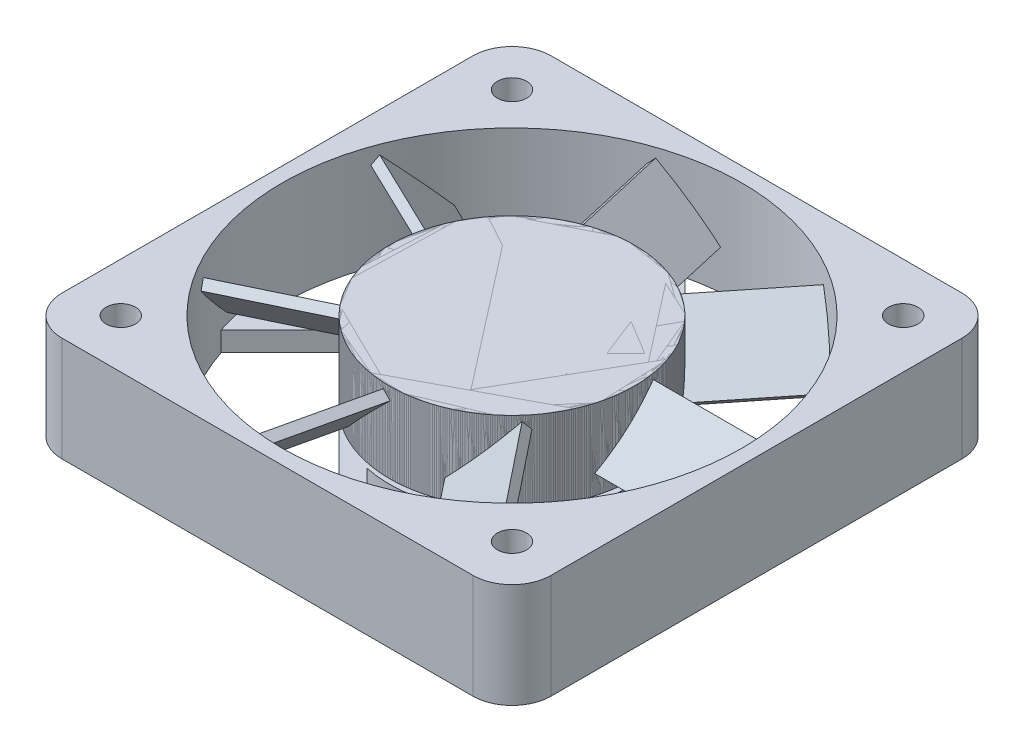
from build123d import *

# Parameters (mm, degrees)
SKETCH1_R                = 23.5
SKETCH1_R_2              = 1.5
BOSS_EXTRUDE1_DEPTH      = 10.7
BOSS_EXTRUDE2_DEPTH      = 2
SKETCH3_R                = 12.5
BOSS_EXTRUDE3_DEPTH      = 8.2
BOSS_EXTRUDE4_REACH      = 38.939
BOSS_EXTRUDE4_END_RADIUS = 23
CIRPATTERN3_COUNT        = 7


with BuildPart() as part:
    # Sketch1 → Boss-Extrude1 (new body)
    with BuildSketch(Plane(origin=(0, 0, 0), x_dir=(1, 0, 0), z_dir=(0, 1, 0))):
        with BuildLine():
            Line((-21, 25), (21, 25))
            ThreePointArc((21, 25), (23.828427125, 23.828427125), (25, 21))
            Line((25, 21), (25, -21))
            ThreePointArc((25, -21), (23.828427125, -23.828427125), (21, -25))
            Line((21, -25), (-21, -25))
            ThreePointArc((-21, -25), (-23.828427125, -23.828427125), (-25, -21))
            Line((-25, -21), (-25, 21))
            ThreePointArc((-25, 21), (-23.828427125, 23.828427125), (-21, 25))
        make_face()
        with Locations(Location((0, 0, 0), (0, 0, 270))):
            Circle(SKETCH1_R, mode=Mode.SUBTRACT)
        with Locations(Location((-20, 20, 0), (0, 0, 270))):
            Circle(SKETCH1_R_2, mode=Mode.SUBTRACT)
        with Locations(Location((20, 20, 0), (0, 0, 270))):
            Circle(SKETCH1_R_2, mode=Mode.SUBTRACT)
        with Locations(Location((20, -20, 0), (0, 0, 270))):
            Circle(SKETCH1_R_2, mode=Mode.SUBTRACT)
        with Locations(Location((-20, -20, 0), (0, 0, 270))):
            Circle(SKETCH1_R_2, mode=Mode.SUBTRACT)
    extrude(amount=BOSS_EXTRUDE1_DEPTH)

    # Sketch2 → Boss-Extrude2 (add)
    with BuildSketch(Plane.XZ):
        with BuildLine():
            Line((-8.838834765, 8.838834765), (5.232412515, 22.910082044))
            ThreePointArc((5.232412515, 22.910082044), (6.34449319, 22.627359682), (7.441447545, 22.29068995))
            Line((7.441447545, 22.29068995), (-2.628789679, 12.220452726))
            ThreePointArc((-2.628789679, 12.220452726), (3.535533906, 11.989578808), (8.838834765, 8.838834765))
            Line((8.838834765, 8.838834765), (22.910082044, -5.232412515))
            ThreePointArc((22.910082044, -5.232412515), (22.627359682, -6.34449319), (22.29068995, -7.441447545))
            Line((22.29068995, -7.441447545), (12.220452726, 2.628789679))
            ThreePointArc((12.220452726, 2.628789679), (11.989578808, -3.535533906), (8.838834765, -8.838834765))
            Line((8.838834765, -8.838834765), (-5.232412515, -22.910082044))
            ThreePointArc((-5.232412515, -22.910082044), (-6.34449319, -22.627359682), (-7.441447545, -22.29068995))
            Line((-7.441447545, -22.29068995), (2.628789679, -12.220452726))
            ThreePointArc((2.628789679, -12.220452726), (-3.535533906, -11.989578808), (-8.838834765, -8.838834765))
            Line((-8.838834765, -8.838834765), (-22.910082044, 5.232412515))
            ThreePointArc((-22.910082044, 5.232412515), (-22.627359682, 6.34449319), (-22.29068995, 7.441447545))
            Line((-22.29068995, 7.441447545), (-12.220452726, -2.628789679))
            ThreePointArc((-12.220452726, -2.628789679), (-11.989578808, 3.535533906), (-8.838834765, 8.838834765))
        make_face()
    extrude(amount=-BOSS_EXTRUDE2_DEPTH)


with BuildPart() as body_2:
    # Sketch3 → Boss-Extrude3 (new body)
    with BuildSketch(Plane(origin=(0, 10.7, 0), x_dir=(1, 0, 0), z_dir=(0, 1, 0))):
        with Locations(Location((0, 0, 0), (0, 0, 270))):
            Circle(SKETCH3_R)
    extrude(amount=-BOSS_EXTRUDE3_DEPTH)

    # Boss-Extrude4: up to this cylinder (the profile starts inside it)
    boss_extrude4_end = Plane(origin=(0, 6.953553, 0), z_dir=(0, -1, 0)) * Cylinder(BOSS_EXTRUDE4_END_RADIUS, 124.878, mode=Mode.PRIVATE)
    # Sketch4 → Boss-Extrude4 (add, up to the surface)
    with BuildSketch(Plane(origin=(0, 0, 0), x_dir=(0, 0, -1), z_dir=(1, 0, 0)), mode=Mode.PRIVATE) as boss_extrude4_sk1:
        Polygon((-3.535533906, 4.478679656), (2.121320344, 10.135533906), (2.828427125, 9.428427125), (-2.828427125, 3.771572875), align=None)
    boss_extrude4_tool1 = extrude(boss_extrude4_sk1.sketch, amount=BOSS_EXTRUDE4_REACH, mode=Mode.PRIVATE) & boss_extrude4_end
    add(boss_extrude4_tool1.solids().sort_by_distance((0, 6.953553, 0.353553))[0])


with BuildPart() as cirpattern3_1:
    # CirPattern3: pattern copy
    add(body_2.part.rotate(Axis((0, 0, 0), (0, 1, 0)), 1 * 360 / CIRPATTERN3_COUNT))


with BuildPart() as cirpattern3_2:
    # CirPattern3: pattern copy
    add(body_2.part.rotate(Axis((0, 0, 0), (0, 1, 0)), 2 * 360 / CIRPATTERN3_COUNT))


with BuildPart() as cirpattern3_3:
    # CirPattern3: pattern copy
    add(body_2.part.rotate(Axis((0, 0, 0), (0, 1, 0)), 3 * 360 / CIRPATTERN3_COUNT))


with BuildPart() as cirpattern3_4:
    # CirPattern3: pattern copy
    add(body_2.part.rotate(Axis((0, 0, 0), (0, 1, 0)), 4 * 360 / CIRPATTERN3_COUNT))


with BuildPart() as cirpattern3_5:
    # CirPattern3: pattern copy
    add(body_2.part.rotate(Axis((0, 0, 0), (0, 1, 0)), 5 * 360 / CIRPATTERN3_COUNT))


with BuildPart() as cirpattern3_6:
    # CirPattern3: pattern copy
    add(body_2.part.rotate(Axis((0, 0, 0), (0, 1, 0)), 6 * 360 / CIRPATTERN3_COUNT))


solid = Compound([part.part, body_2.part, cirpattern3_1.part, cirpattern3_2.part, cirpattern3_3.part, cirpattern3_4.part, cirpattern3_5.part, cirpattern3_6.part])
